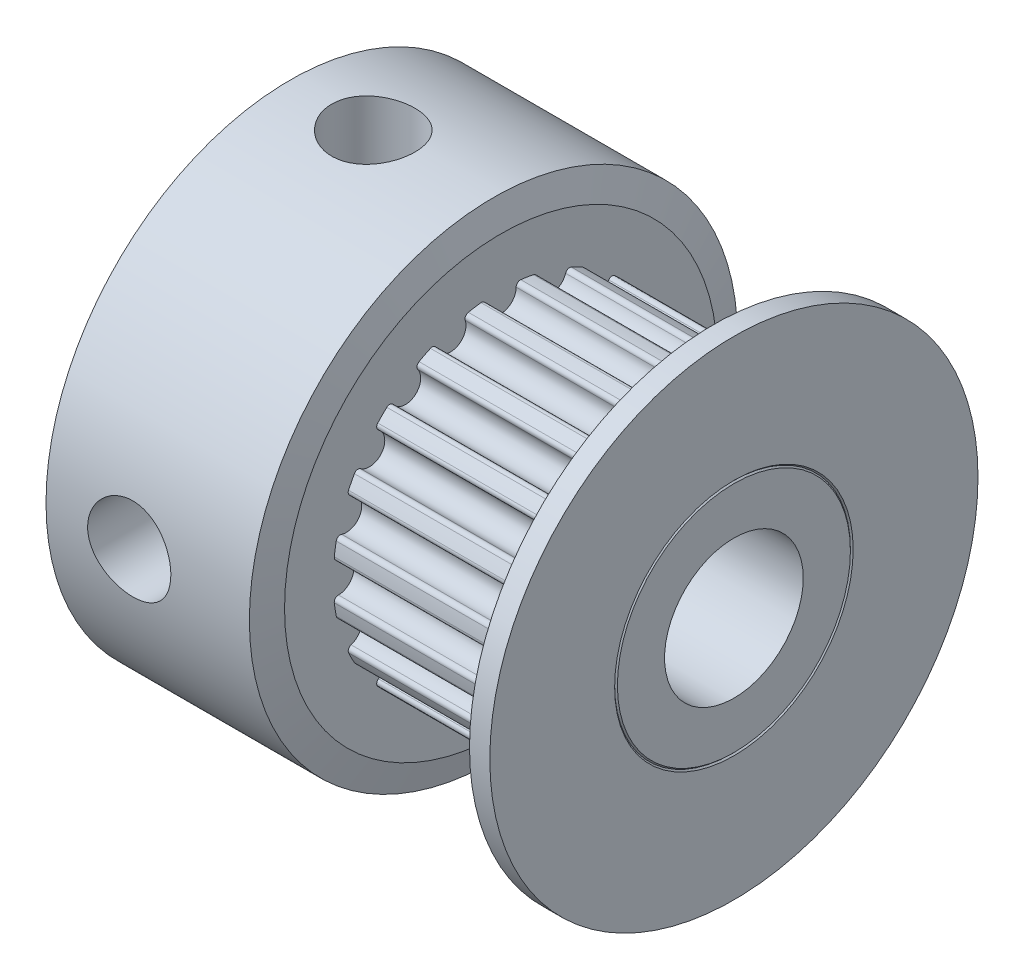
from build123d import *

# Parameters (mm, degrees)
SKETCH_2_R              = 2.5
BORE_DEPTH              = 21.270175135
SKETCH_3_R              = 0.55
F_20TOOTH_DEPTH         = 7.4
FILETS_R                = 0.15
SKETCH_4_R              = 1.5
SET_SCREW_DEPTH         = 21.270175135
SET_SCREW_PATTERN_COUNT = 2
SET_SCREW_PATTERN_ANGLE = 270


with BuildPart() as part:
    # Sketch1 → Body (revolve)
    with BuildSketch(Plane.XY, mode=Mode.PRIVATE) as body_sk:
        Polygon((0, 8.8), (0, 0), (16, 0), (16, 4.2), (15.95, 4.25), (16, 4.3), (16, 8.8), (15.267949192, 8.8), (15, 7.8), (15, 6.05), (7.6, 6.05), (7.6, 7.8), (7.332050808, 8.8), (6.6, 8.8), align=None)
    revolve(body_sk.sketch.rotate(Axis((0, 0, 0), (1, 0, 0)), 90), axis=Axis((0, 0, 0), (1, 0, 0)))

    # Sketch 2 → Bore (cut, through all)
    with BuildSketch(Plane(origin=(16, 0, 0), x_dir=(0, 0, -1), z_dir=(1, 0, 0))):
        Circle(SKETCH_2_R)
    extrude(amount=-BORE_DEPTH, mode=Mode.SUBTRACT)

    # Sketch 3 → 20tooth (cut)
    with BuildSketch(Plane(origin=(7.6, 0, 0), x_dir=(0, 0, -1), z_dir=(1, 0, 0))):
        with Locations((5.568435903, -1.809294502)):
            Circle(SKETCH_3_R)
        with Locations((4.736794502, -3.441482652)):
            Circle(SKETCH_3_R)
        with Locations((3.441482652, -4.736794502)):
            Circle(SKETCH_3_R)
        with Locations((1.809294502, -5.568435903)):
            Circle(SKETCH_3_R)
        with Locations((0, -5.855)):
            Circle(SKETCH_3_R)
        with Locations((5.855, 0)):
            Circle(SKETCH_3_R)
        with Locations((-1.809294502, -5.568435903)):
            Circle(SKETCH_3_R)
        with Locations((-3.441482652, -4.736794502)):
            Circle(SKETCH_3_R)
        with Locations((-4.736794502, -3.441482652)):
            Circle(SKETCH_3_R)
        with Locations((-5.568435903, -1.809294502)):
            Circle(SKETCH_3_R)
        with Locations((-5.855, 0)):
            Circle(SKETCH_3_R)
        with Locations((-5.568435903, 1.809294502)):
            Circle(SKETCH_3_R)
        with Locations((-4.736794502, 3.441482652)):
            Circle(SKETCH_3_R)
        with Locations((-3.441482652, 4.736794502)):
            Circle(SKETCH_3_R)
        with Locations((-1.809294502, 5.568435903)):
            Circle(SKETCH_3_R)
        with Locations((0, 5.855)):
            Circle(SKETCH_3_R)
        with Locations((1.809294502, 5.568435903)):
            Circle(SKETCH_3_R)
        with Locations((3.441482652, 4.736794502)):
            Circle(SKETCH_3_R)
        with Locations((4.736794502, 3.441482652)):
            Circle(SKETCH_3_R)
        with Locations((5.568435903, 1.809294502)):
            Circle(SKETCH_3_R)
    extrude(amount=F_20TOOTH_DEPTH, mode=Mode.SUBTRACT)

    # Filets
    filets_edges = [part.edges().sort_by_distance(p)[0] for p in [
        (11.3, -4.569294161, 3.965356335),
        (11.3, -5.18326753, 3.120294491),
        (11.3, -3.120294491, 5.18326753),
        (11.3, -3.965356335, 4.569294161),
        (11.3, -1.365858655, 5.893804386),
        (11.3, -2.359288434, 5.571019483),
        (11.3, 0.522276943, 6.027414603),
        (11.3, -0.522276943, 6.027414603),
        (11.3, 2.359288434, 5.571019483),
        (11.3, 1.365858655, 5.893804386),
        (11.3, 3.965356335, 4.569294161),
        (11.3, 3.120294491, 5.18326753),
        (11.3, 5.18326753, 3.120294491),
        (11.3, 4.569294161, 3.965356335),
        (11.3, 5.893804386, 1.365858655),
        (11.3, 5.571019483, 2.359288434),
        (11.3, 6.027414603, -0.522276943),
        (11.3, 6.027414603, 0.522276943),
        (11.3, 5.571019483, -2.359288434),
        (11.3, 5.893804386, -1.365858655),
        (11.3, 4.569294161, -3.965356335),
        (11.3, 5.18326753, -3.120294491),
        (11.3, 3.120294491, -5.18326753),
        (11.3, 3.965356335, -4.569294161),
        (11.3, 1.365858655, -5.893804386),
        (11.3, 2.359288434, -5.571019483),
        (11.3, -2.359288434, -5.571019483),
        (11.3, -1.365858655, -5.893804386),
        (11.3, -3.965356335, -4.569294161),
        (11.3, -3.120294491, -5.18326753),
        (11.3, -5.18326753, -3.120294491),
        (11.3, -4.569294161, -3.965356335),
        (11.3, -5.893804386, -1.365858655),
        (11.3, -5.571019483, -2.359288434),
        (11.3, -6.027414603, 0.522276943),
        (11.3, -6.027414603, -0.522276943),
        (11.3, -0.522276943, -6.027414603),
        (11.3, 0.522276943, -6.027414603),
        (11.3, -5.571019483, 2.359288434),
        (11.3, -5.893804386, 1.365858655),
    ]]
    fillet(filets_edges, radius=FILETS_R)

    # Sketch 4 → Set screw (cut, through all)
    with BuildSketch(Plane.XY):
        with Locations(Location((3, 0, 0), (0, 0, 180))):
            Circle(SKETCH_4_R)
    set_screw = extrude(amount=SET_SCREW_DEPTH, mode=Mode.SUBTRACT)

    # Set screw pattern: Set screw ×2 about axis
    set_screw_pattern_axis = Axis((0, 0, 0), (1, 0, 0))
    for i in range(1, SET_SCREW_PATTERN_COUNT):
        add(set_screw.rotate(set_screw_pattern_axis, i * SET_SCREW_PATTERN_ANGLE / (SET_SCREW_PATTERN_COUNT - 1)), mode=Mode.SUBTRACT)


solid = part.part
